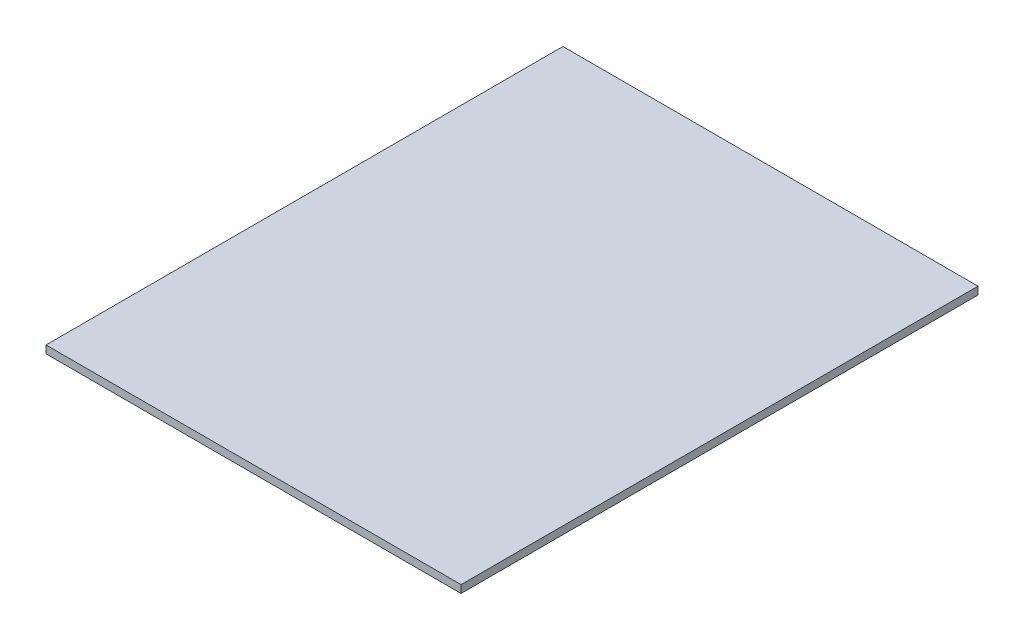
from build123d import *

# Parameters (mm, degrees)
SKETCH1_W           = 93.95
SKETCH1_H           = 117
BOSS_EXTRUDE1_DEPTH = 1.74


with BuildPart() as part:
    # Sketch1 → Boss-Extrude1 (new body)
    with BuildSketch(Plane(origin=(0, 0, 0), x_dir=(1, 0, 0), z_dir=(0, 1, 0))):
        with Locations((46.975, 58.5)):
            Rectangle(SKETCH1_W, SKETCH1_H)
    extrude(amount=BOSS_EXTRUDE1_DEPTH)


solid = part.part
